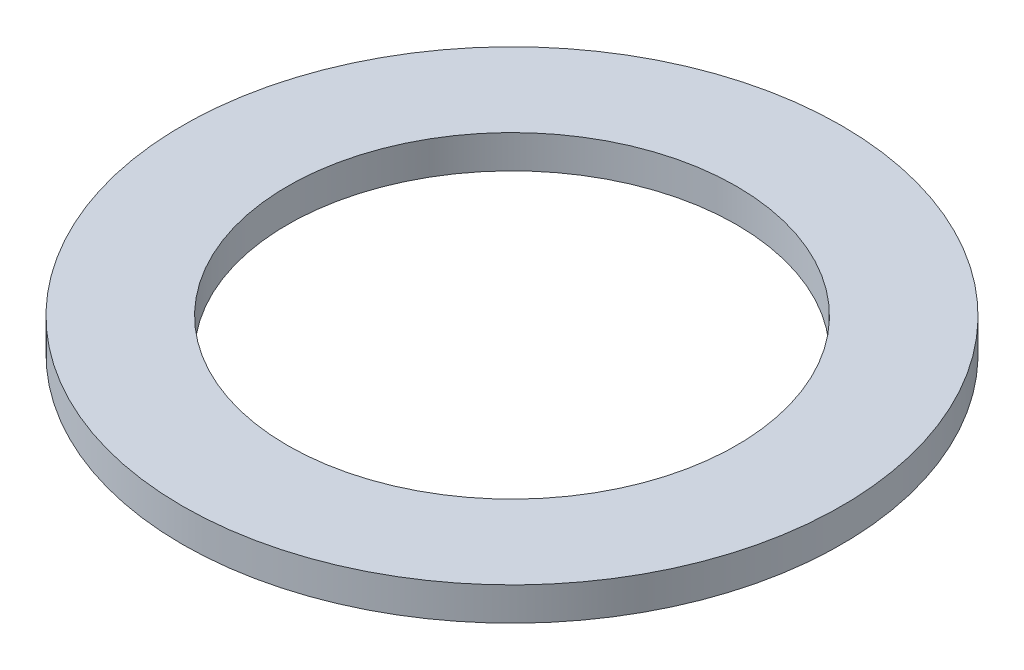
from build123d import *

# Parameters (mm, degrees)
SKETCH1_R           = 29.8
SKETCH1_R_2         = 20.3
BOSS_EXTRUDE1_DEPTH = 3


with BuildPart() as part:
    # Sketch1 → Boss-Extrude1 (new body)
    with BuildSketch(Plane(origin=(0, 0, 0), x_dir=(1, 0, 0), z_dir=(0, 1, 0))):
        with Locations(Location((0, 0, 0), (0, 0, 270))):
            Circle(SKETCH1_R)
        with Locations(Location((0, 0, 0), (0, 0, 270))):
            Circle(SKETCH1_R_2, mode=Mode.SUBTRACT)
    extrude(amount=BOSS_EXTRUDE1_DEPTH)


solid = part.part
